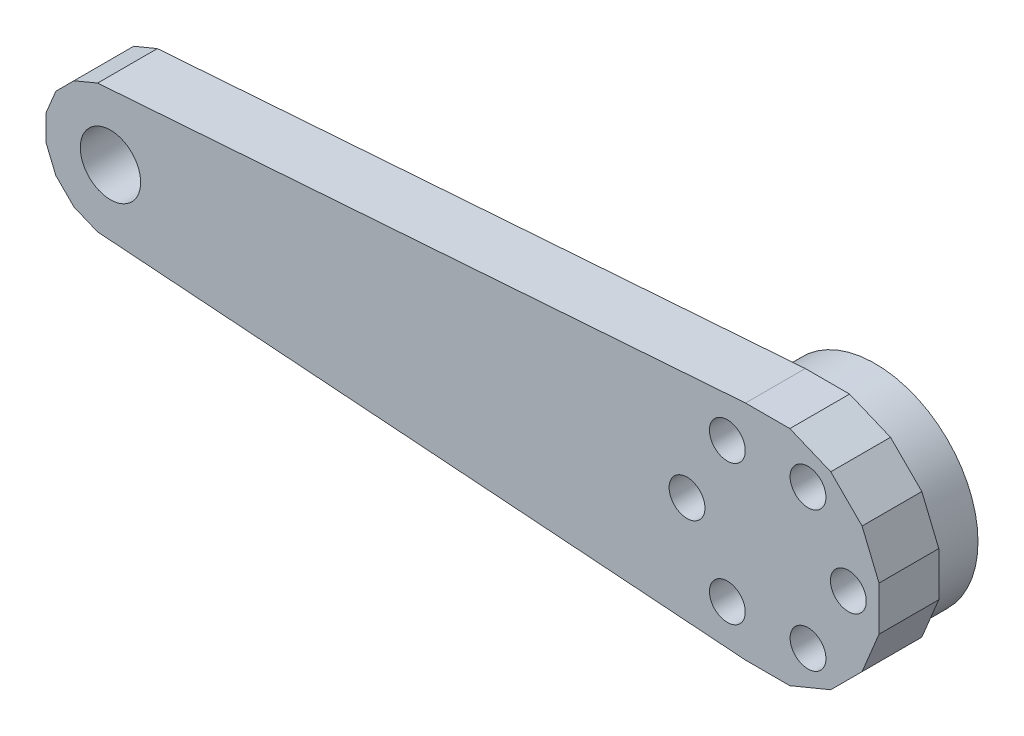
from build123d import *

# Parameters (mm, degrees)
ARM_WEB_START               = 8
PROFILE_1_R                 = 5.05
PROFILE_1_R_2               = 1.65
ARM_WEB_DEPTH               = 10
PROFILE_2_R                 = 17.2
PROFILE_2_R_2               = 5
PROFILE_2_R_3               = 1.65
ROTOR_STANDOFF_DEPTH        = 8
ROTOR_SCREW_SPOTFACES_START = 12
PROFILE_3_R                 = 3
ROTOR_SCREW_SPOTFACES_DEPTH = 6.01


with BuildPart() as part:
    # Profile_1 → Arm_web (new body)
    with BuildSketch(Plane.XY.offset(ARM_WEB_START)):
        Polygon((-116.111272563, 9.146165735), (-119.146165735, 6.111272563), (-120.788638084, 2.145993542), (-120.788638084, -2.145993542), (-119.146165735, -6.111272563), (-116.111272563, -9.146165735), (-112.145993542, -10.788638084), (-3.706716118, -18.634920328), (3.706716118, -18.634920328), (10.555834427, -15.797922634), (15.797922634, -10.555834427), (18.634920328, -3.706716118), (18.634920328, 3.706716118), (15.797922634, 10.555834427), (10.555834427, 15.797922634), (3.706716118, 18.634920328), (-3.706716118, 18.634920328), (-112.145993542, 10.788638084), align=None)
        with Locations((-110, 0)):
            Circle(PROFILE_1_R, mode=Mode.SUBTRACT)
        with Locations((-13.5, 0)):
            Circle(PROFILE_1_R_2, mode=Mode.SUBTRACT)
        with Locations((-6.75, 11.691342951)):
            Circle(PROFILE_1_R_2, mode=Mode.SUBTRACT)
        with Locations((6.75, 11.691342951)):
            Circle(PROFILE_1_R_2, mode=Mode.SUBTRACT)
        with Locations((13.5, 0)):
            Circle(PROFILE_1_R_2, mode=Mode.SUBTRACT)
        with Locations((6.75, -11.691342951)):
            Circle(PROFILE_1_R_2, mode=Mode.SUBTRACT)
        with Locations((-6.75, -11.691342951)):
            Circle(PROFILE_1_R_2, mode=Mode.SUBTRACT)
    extrude(amount=ARM_WEB_DEPTH)

    # Profile_2 → Rotor_standoff (add)
    with BuildSketch(Plane.XY):
        Circle(PROFILE_2_R)
        Circle(PROFILE_2_R_2, mode=Mode.SUBTRACT)
        with Locations((-13.5, 0)):
            Circle(PROFILE_2_R_3, mode=Mode.SUBTRACT)
        with Locations((-6.75, 11.691342951)):
            Circle(PROFILE_2_R_3, mode=Mode.SUBTRACT)
        with Locations((6.75, 11.691342951)):
            Circle(PROFILE_2_R_3, mode=Mode.SUBTRACT)
        with Locations((13.5, 0)):
            Circle(PROFILE_2_R_3, mode=Mode.SUBTRACT)
        with Locations((6.75, -11.691342951)):
            Circle(PROFILE_2_R_3, mode=Mode.SUBTRACT)
        with Locations((-6.75, -11.691342951)):
            Circle(PROFILE_2_R_3, mode=Mode.SUBTRACT)
    extrude(amount=ROTOR_STANDOFF_DEPTH)

    # Profile_3 → Rotor_screw_spotfaces (cut)
    with BuildSketch(Plane.XY.offset(ROTOR_SCREW_SPOTFACES_START)):
        with Locations(Location((-13.5, 0, 0), (0, 0, 180))):
            Circle(PROFILE_3_R)
        with Locations(Location((-6.75, 11.691342951, 0), (0, 0, 180))):
            Circle(PROFILE_3_R)
        with Locations(Location((6.75, 11.691342951, 0), (0, 0, 180))):
            Circle(PROFILE_3_R)
        with Locations(Location((13.5, 0, 0), (0, 0, 180))):
            Circle(PROFILE_3_R)
        with Locations(Location((6.75, -11.691342951, 0), (0, 0, 180))):
            Circle(PROFILE_3_R)
        with Locations(Location((-6.75, -11.691342951, 0), (0, 0, 180))):
            Circle(PROFILE_3_R)
    extrude(amount=ROTOR_SCREW_SPOTFACES_DEPTH, mode=Mode.SUBTRACT)


solid = part.part
